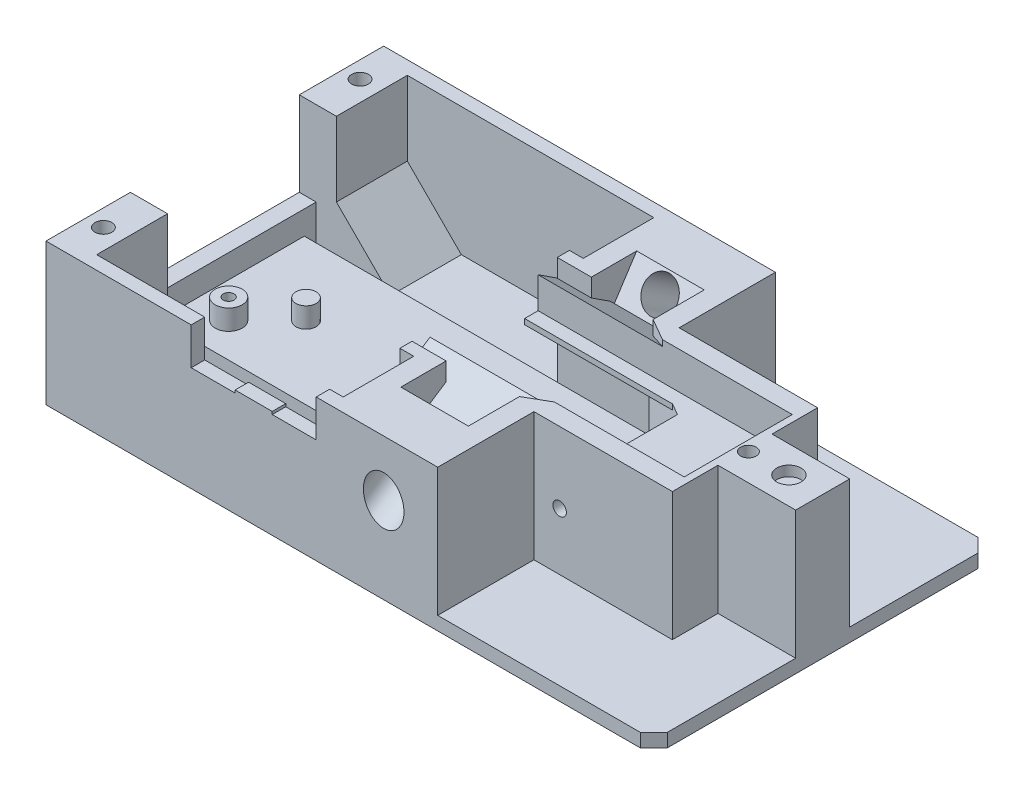
from build123d import *

# Parameters (mm, degrees)
SKETCH1_W           = 90
SKETCH1_H           = 50
BOSS_EXTRUDE1_DEPTH = 21
CUT_EXTRUDE1_DEPTH  = 16
SKETCH4_R           = 2.5
CUT_EXTRUDE2_DEPTH  = 83.6791072
SKETCH5_W           = 10
SKETCH5_H           = 6.2
CUT_EXTRUDE3_DEPTH  = 19
SKETCH6_R           = 3
CUT_EXTRUDE4_DEPTH  = 20
SKETCH11_R          = 1.5
BOSS_EXTRUDE3_DEPTH = 3
BOSS_EXTRUDE2_DEPTH = 23.630686795
CUT_EXTRUDE6_DEPTH  = 19
SKETCH17_W          = 16
SKETCH17_H          = 3.2
CUT_EXTRUDE10_DEPTH = 37.549475977
SKETCH15_R          = 1.8
CUT_EXTRUDE8_DEPTH  = 1.5
SKETCH16_R          = 1.25
CUT_EXTRUDE9_DEPTH  = 19
CUT_EXTRUDE11_REACH = 61.716
SKETCH19_R          = 4
CHAMFER1_SIZE       = 8
CHAMFER2_SIZE       = 2
CUT_EXTRUDE12_REACH = 75.763
SKETCH21_W          = 21.5
SKETCH21_H          = 3
BOSS_EXTRUDE4_DEPTH = 5.5
CUT_EXTRUDE13_REACH = 61.716
SKETCH23_W          = 37.630686795
SKETCH23_H          = 16
SKETCH25_R          = 1.15
CUT_EXTRUDE14_DEPTH = 10
SKETCH26_R          = 1
CUT_EXTRUDE15_DEPTH = 65.954310865
SKETCH27_W          = 2.5
SKETCH27_H          = 25
BOSS_EXTRUDE6_DEPTH = 6.5
SKETCH28_W          = 10
SKETCH28_H          = 0.8
CUT_EXTRUDE16_DEPTH = 4
SKETCH22_R          = 2
SKETCH22_R_2        = 0.8
BOSS_EXTRUDE7_DEPTH = 3


with BuildPart() as part:
    # Sketch1 → Boss-Extrude1 (new body)
    with BuildSketch(Plane(origin=(0, 0, 0), x_dir=(1, 0, 0), z_dir=(0, 1, 0))):
        with Locations((-5, 0)):
            Rectangle(SKETCH1_W, SKETCH1_H)
    extrude(amount=BOSS_EXTRUDE1_DEPTH)

    # Sketch2 → Cut-Extrude1 (cut)
    with BuildSketch(Plane(origin=(0, 21, 0), x_dir=(1, 0, 0), z_dir=(0, 1, 0))):
        Polygon((-44.5, 10.75), (3.5, 10.75), (13.5, 5), (13.5, -5), (3.5, -10.75), (-44.5, -10.75), align=None)
    extrude(amount=-CUT_EXTRUDE1_DEPTH, mode=Mode.SUBTRACT)

    # Sketch4 → Cut-Extrude2 (cut, through all)
    with BuildSketch(Plane(origin=(0, 3.891653574, -38.585684316), x_dir=(1, 0, 0), z_dir=(0, 0.5454105354285889, 0.8381690449089015))):
        with Locations(Location((0, 0, 0), (0, 0, 340.313364842))):
            Circle(SKETCH4_R)
    cut_extrude2 = extrude(amount=CUT_EXTRUDE2_DEPTH, mode=Mode.SUBTRACT)

    # Sketch5 → Cut-Extrude3 (cut)
    with BuildSketch(Plane(origin=(0, 29, 0), x_dir=(1, 0, 0), z_dir=(0, 0.5454105354285889, 0.8381690449089015))):
        with Locations((0, 0.013708289)):
            Rectangle(SKETCH5_W, SKETCH5_H)
    cut_extrude3 = extrude(amount=-CUT_EXTRUDE3_DEPTH, mode=Mode.SUBTRACT)

    # Sketch6 → Cut-Extrude4 (cut)
    with BuildSketch(Plane(origin=(0, 3.891653574, -38.585684316), x_dir=(1, 0, 0), z_dir=(0, 0.5454105354285889, 0.8381690449089015))):
        with Locations(Location((0, 0, 0), (0, 0, 270))):
            Circle(SKETCH6_R)
    cut_extrude4 = extrude(amount=CUT_EXTRUDE4_DEPTH, mode=Mode.SUBTRACT)

    # Sketch11 → Boss-Extrude3 (add)
    with BuildSketch(Plane(origin=(0, 5, 0), x_dir=(1, 0, 0), z_dir=(0, 1, 0))):
        with Locations(Location((-36.5, 0, 0), (0, 0, 270))):
            Circle(SKETCH11_R)
        Polygon((11.3, 6.265), (11.3, -6.265), (13.5, -5), (13.5, 5), align=None)
    extrude(amount=BOSS_EXTRUDE3_DEPTH)

    # Sketch9 → Boss-Extrude2 (add)
    with BuildSketch(Plane.ZY.offset(-13.5)):
        Polygon((-8, 18.7), (-8, 15.5), (-6, 15.5), (-6, 14.7), (-10.75, 13.6), (-11.152370245, 13.6), (-11.152370245, 14.662668332), (-11.152370245, 18.060784345), (-6.635479906, 21), (0, 21), (0, 18.7), align=None)
    boss_extrude2 = extrude(amount=BOSS_EXTRUDE2_DEPTH)

    # Mirror1: Cut-Extrude2, Cut-Extrude3, Cut-Extrude4, Boss-Extrude2 across plane
    add(cut_extrude2.mirror(Plane.XY), mode=Mode.SUBTRACT)
    add(cut_extrude3.mirror(Plane.XY), mode=Mode.SUBTRACT)
    add(cut_extrude4.mirror(Plane.XY), mode=Mode.SUBTRACT)
    add(boss_extrude2.mirror(Plane.XY))

    # Sketch10 → Cut-Extrude6 (cut)
    with BuildSketch(Plane(origin=(0, 21, 0), x_dir=(1, 0, 0), z_dir=(0, 1, 0))):
        Polygon((-44.5, 12.5), (-44.5, 23), (-8, 23), (-8, 12.55), (-10.049475977, 12.55), (-10.049475977, 10.75), (-44.5, 10.75), (-44.5, 0), (-50, 0), (-50, 12.5), align=None)
        Polygon((8, 25), (8, 10.75), (28.5, 10.75), (28.5, 4), (46.328078386, 4), (46.328078386, 30.717572765), (8, 31.044325351), align=None)
    cut_extrude6 = extrude(amount=-CUT_EXTRUDE6_DEPTH, mode=Mode.SUBTRACT)

    # Mirror2: Cut-Extrude6 across plane
    add(cut_extrude6.mirror(Plane.XY), mode=Mode.SUBTRACT)

    # Sketch17 → Cut-Extrude10 (cut)
    with BuildSketch(Plane.ZY.offset(10.049475977)):
        with Locations((0, 17.1)):
            Rectangle(SKETCH17_W, SKETCH17_H)
    extrude(amount=-CUT_EXTRUDE10_DEPTH, mode=Mode.SUBTRACT)

    # Sketch15 → Cut-Extrude8 (cut)
    with BuildSketch(Plane(origin=(0, 21, 0), x_dir=(1, 0, 0), z_dir=(0, 1, 0))):
        with Locations(Location((35, 0, 0), (0, 0, 270))):
            Circle(SKETCH15_R)
    extrude(amount=-CUT_EXTRUDE8_DEPTH, mode=Mode.SUBTRACT)

    # Sketch16 → Cut-Extrude9 (cut)
    with BuildSketch(Plane(origin=(0, 21, 0), x_dir=(1, 0, 0), z_dir=(0, 1, 0))):
        with Locations(Location((-47.5, 19, 0), (0, 0, 270))):
            Circle(SKETCH16_R)
        with Locations(Location((-47.5, -19, 0), (0, 0, 270))):
            Circle(SKETCH16_R)
    extrude(amount=-CUT_EXTRUDE9_DEPTH, mode=Mode.SUBTRACT)

    # Sketch19 → Cut-Extrude11 (cut, up to next)
    with BuildSketch(Plane(origin=(0, 21, 0), x_dir=(1, 0, 0), z_dir=(0, 1, 0)), mode=Mode.PRIVATE) as cut_extrude11_sk1:
        with Locations(Location((0, 0, 0), (0, 0, 270))):
            Circle(SKETCH19_R)
    cut_extrude11_tool1 = extrude(cut_extrude11_sk1.sketch, amount=-CUT_EXTRUDE11_REACH, mode=Mode.PRIVATE) & part.part
    add(cut_extrude11_tool1.solids().sort_by_distance((0, 21, 0))[0], mode=Mode.SUBTRACT)

    # Chamfer1
    chamfer1_edges = [part.edges().sort_by_distance(p)[0] for p in [
        (-44.5, 2, -17.75),
        (-44.5, 2, 17.75),
    ]]
    chamfer(chamfer1_edges, length=CHAMFER1_SIZE)

    # Chamfer2
    chamfer2_edges = [part.edges().sort_by_distance(p)[0] for p in [
        (40, 1, -25),
        (40, 1, 25),
    ]]
    chamfer(chamfer2_edges, length=CHAMFER2_SIZE)

    # Sketch20 → Cut-Extrude12 (cut, up to next)
    with BuildSketch(Plane.XY.offset(25), mode=Mode.PRIVATE) as cut_extrude12_sk1:
        Polygon((-28.5, 15.5), (-22, 15.5), (-22, 15.9), (-16.5, 15.9), (-16.5, 15.5), (-10, 15.5), (-10, 21), (-28.5, 21), (-28.5, 15.8), align=None)
    cut_extrude12_tool1 = extrude(cut_extrude12_sk1.sketch, amount=-CUT_EXTRUDE12_REACH, mode=Mode.PRIVATE) & part.part
    add(cut_extrude12_tool1.solids().sort_by_distance((-19.25, 18.306354, 25))[0], mode=Mode.SUBTRACT)

    # Sketch21 → Boss-Extrude4 (add)
    with BuildSketch(Plane.ZY.offset(44.5)):
        with Locations((0, 3.5)):
            Rectangle(SKETCH21_W, SKETCH21_H)
    extrude(amount=BOSS_EXTRUDE4_DEPTH)

    # Sketch23 → Cut-Extrude13 (cut, up to next)
    with BuildSketch(Plane(origin=(0, 21, 0), x_dir=(1, 0, 0), z_dir=(0, 1, 0)), mode=Mode.PRIVATE) as cut_extrude13_sk1:
        with Locations((8.684656602, 0)):
            Rectangle(SKETCH23_W, SKETCH23_H)
    cut_extrude13_tool1 = extrude(cut_extrude13_sk1.sketch, amount=-CUT_EXTRUDE13_REACH, mode=Mode.PRIVATE) & part.part
    add(cut_extrude13_tool1.solids().sort_by_distance((8.684657, 21, 0))[0], mode=Mode.SUBTRACT)

    # Sketch25 → Cut-Extrude14 (cut)
    with BuildSketch(Plane(origin=(0, 21, 0), x_dir=(1, 0, 0), z_dir=(0, 1, 0))):
        with Locations(Location((29, 0, 0), (0, 0, 270))):
            Circle(SKETCH25_R)
    extrude(amount=-CUT_EXTRUDE14_DEPTH, mode=Mode.SUBTRACT)

    # Sketch26 → Cut-Extrude15 (cut, through all)
    with BuildSketch(Plane.XY.offset(10.75)):
        with Locations((11.80251356, 10.471486046)):
            Circle(SKETCH26_R)
    extrude(amount=-CUT_EXTRUDE15_DEPTH, mode=Mode.SUBTRACT)

    # Sketch27 → Boss-Extrude6 (add)
    with BuildSketch(Plane(origin=(0, 2, 0), x_dir=(1, 0, 0), z_dir=(0, 1, 0))):
        with Locations((-48.75, 0)):
            Rectangle(SKETCH27_W, SKETCH27_H)
    extrude(amount=BOSS_EXTRUDE6_DEPTH)

    # Sketch28 → Cut-Extrude16 (cut)
    with BuildSketch(Plane(origin=(0, 17.786458912, 11.573944585), x_dir=(1, 0, 0), z_dir=(0, 0.8381690449089014, 0.545410535428589))):
        with Locations((0, -2.783094473)):
            Rectangle(SKETCH28_W, SKETCH28_H)
    cut_extrude16 = extrude(amount=-CUT_EXTRUDE16_DEPTH, mode=Mode.SUBTRACT)

    # Mirror3: Cut-Extrude16 across plane
    add(cut_extrude16.mirror(Plane.XY), mode=Mode.SUBTRACT)

    # Sketch22 → Boss-Extrude7 (add)
    # profile 1 of 2: a face of its own
    with BuildSketch(Plane(origin=(0, 5, 0), x_dir=(1, 0, 0), z_dir=(0, 1, 0))):
        with Locations(Location((-42.3, -5.65, 0), (0, 0, 270))):
            Circle(SKETCH22_R)
        with Locations(Location((-42.3, -5.65, 0), (0, 0, 270))):
            Circle(SKETCH22_R_2, mode=Mode.SUBTRACT)
    # profile 2 of 2: a face of its own
    with BuildSketch(Plane(origin=(0, 5, 0), x_dir=(1, 0, 0), z_dir=(0, 1, 0))):
        with Locations((9.66, 4.95)):
            Circle(SKETCH22_R)
        with Locations(Location((9.66, 4.95, 0), (0, 0, 270))):
            Circle(SKETCH22_R_2, mode=Mode.SUBTRACT)
    extrude(amount=BOSS_EXTRUDE7_DEPTH)


solid = part.part
